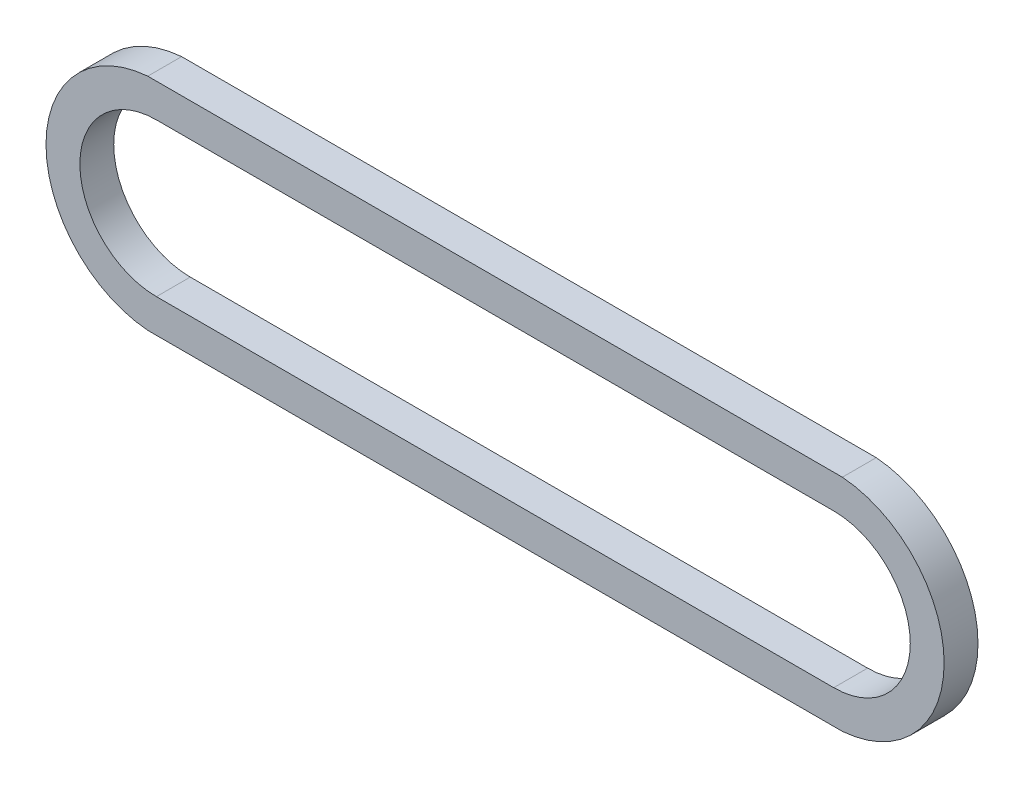
from build123d import *

# Parameters (mm, degrees)
SKETCH1_W           = 168.402
SKETCH1_H           = 41.275
BOSS_EXTRUDE1_DEPTH = 6.35
CUT_EXTRUDE1_DEPTH  = 87.925469842
CUT_EXTRUDE2_DEPTH  = 87.925469842


with BuildPart() as part:
    # Sketch1 → Boss-Extrude1 (new body)
    with BuildSketch(Plane.XY):
        Rectangle(SKETCH1_W, SKETCH1_H)
    extrude(amount=BOSS_EXTRUDE1_DEPTH)

    # Sketch2 → Cut-Extrude1 (cut, through all)
    with BuildSketch(Plane.XY.offset(6.35)):
        with BuildLine():
            Line((63.5, -14.351), (-63.5, -14.351))
            ThreePointArc((-63.5, -14.351), (-77.851, 0), (-63.5, 14.351))
            Line((-63.5, 14.351), (63.5, 14.351))
            ThreePointArc((63.5, 14.351), (77.851, 0), (63.5, -14.351))
        make_face()
    extrude(amount=-CUT_EXTRUDE1_DEPTH, mode=Mode.SUBTRACT)

    # Sketch5 → Cut-Extrude2 (cut, through all)
    with BuildSketch(Plane.XY.offset(6.35)):
        with BuildLine():
            ThreePointArc((-84.201, -7.7e-08), (-78.699849051, 14.053326646), (-65.120183554, 20.6375))
            Line((-65.120183554, 20.6375), (-84.201, 20.6375))
            Line((-84.201, 20.6375), (-84.201, -7.7e-08))
        make_face()
        with BuildLine():
            ThreePointArc((-65.120183554, -20.6375), (-78.699848999, -14.053326703), (-84.201, -7.7e-08))
            Line((-84.201, -7.7e-08), (-84.201, -20.6375))
            Line((-84.201, -20.6375), (-65.120183554, -20.6375))
        make_face()
        with BuildLine():
            Line((84.201, 20.6375), (65.120183554, 20.6375))
            ThreePointArc((65.120183554, 20.6375), (78.699849025, 14.053326674), (84.201, 0))
            Line((84.201, 0), (84.201, 20.6375))
        make_face()
        with BuildLine():
            Line((84.201, -20.6375), (84.201, 0))
            ThreePointArc((84.201, 0), (78.699849025, -14.053326674), (65.120183554, -20.6375))
            Line((65.120183554, -20.6375), (84.201, -20.6375))
        make_face()
    extrude(amount=-CUT_EXTRUDE2_DEPTH, mode=Mode.SUBTRACT)


solid = part.part
